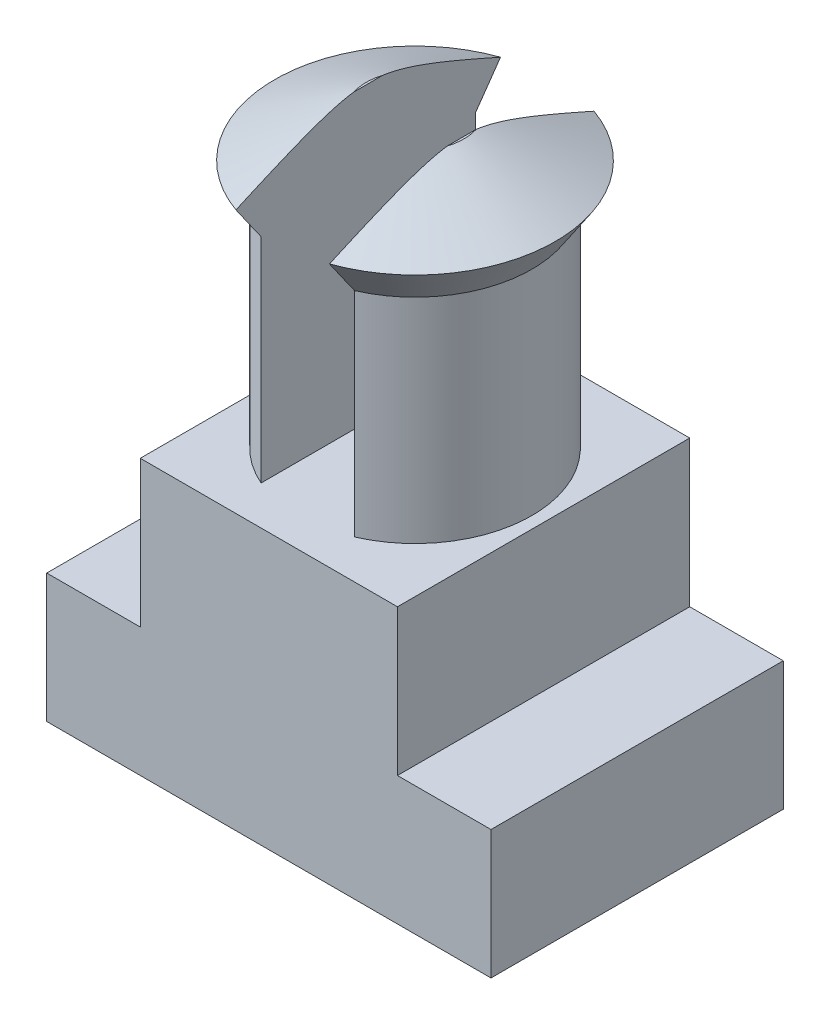
from build123d import *

# Parameters (mm, degrees)
BOSS_EXTRUDE1_DEPTH     = 3.175
CUT_EXTRUDE1_DEPTH      = 16.968703454
CUT_EXTRUDE1_DEPTH_BACK = 16.968703454
SKETCH4_W               = 2.032
SKETCH4_H               = 12.7


with BuildPart() as part:
    # Sketch1 → Boss-Extrude1 (new, symmetric)
    with BuildSketch(Plane.XY):
        Polygon((0, 0), (9.652, 0), (9.652, 2.794), (7.62, 2.794), (7.62, 5.969), (2.032, 5.969), (2.032, 2.794), (0, 2.794), align=None)
    extrude(amount=BOSS_EXTRUDE1_DEPTH, both=True)

    # Sketch3 → Revolve1 (revolve)
    with BuildSketch(Plane.XY, mode=Mode.PRIVATE) as revolve1_sk:
        Polygon((3.76219647, 12.319), (4.326476153, 12.319), (4.326476153, 5.969), (2.286, 5.969), (2.286, 10.6045), (1.778, 11.38048125), align=None)
    revolve(revolve1_sk.sketch.rotate(Axis((4.826, 5.969, 0), (0, 1, 0)), 270), axis=Axis((4.826, 5.969, 0), (0, 1, 0)))

    # Sketch4 → Cut-Extrude1 (cut, two sides: drawn at the far end of the back side and taken through both)
    with BuildSketch(Plane.XY.offset(-CUT_EXTRUDE1_DEPTH_BACK)):
        with Locations((4.826, 12.319)):
            Rectangle(SKETCH4_W, SKETCH4_H)
    extrude(amount=CUT_EXTRUDE1_DEPTH + CUT_EXTRUDE1_DEPTH_BACK, mode=Mode.SUBTRACT)


solid = part.part
